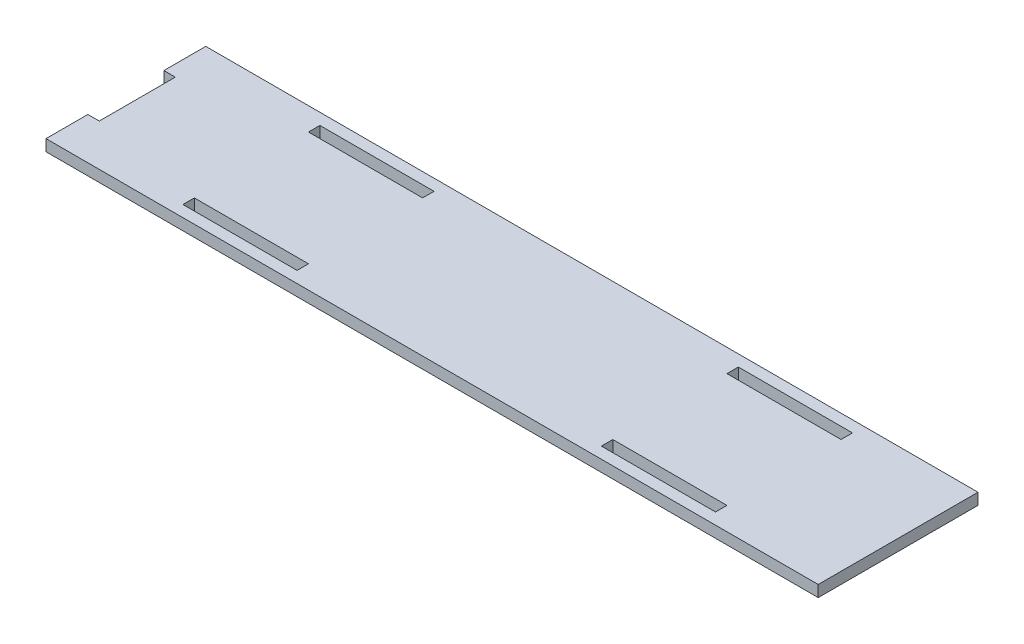
from build123d import *

# Parameters (mm, degrees)
SKETCH1_W           = 30
SKETCH1_H           = 3
BOSS_EXTRUDE1_DEPTH = 3


with BuildPart() as part:
    # Sketch1 → Boss-Extrude1 (new body)
    with BuildSketch(Plane(origin=(0, 0, 0), x_dir=(1, 0, 0), z_dir=(0, 1, 0))):
        Polygon((0, 31), (0, 42), (203, 42), (203, 0), (0, 0), (0, 11), (3, 11), (3, 31), align=None)
        with Locations((48, 4.5)):
            Rectangle(SKETCH1_W, SKETCH1_H, mode=Mode.SUBTRACT)
        with Locations((158, 4.5)):
            Rectangle(SKETCH1_W, SKETCH1_H, mode=Mode.SUBTRACT)
        with Locations((158, 37.5)):
            Rectangle(SKETCH1_W, SKETCH1_H, mode=Mode.SUBTRACT)
        with Locations((48, 37.5)):
            Rectangle(SKETCH1_W, SKETCH1_H, mode=Mode.SUBTRACT)
    extrude(amount=BOSS_EXTRUDE1_DEPTH)


solid = part.part
